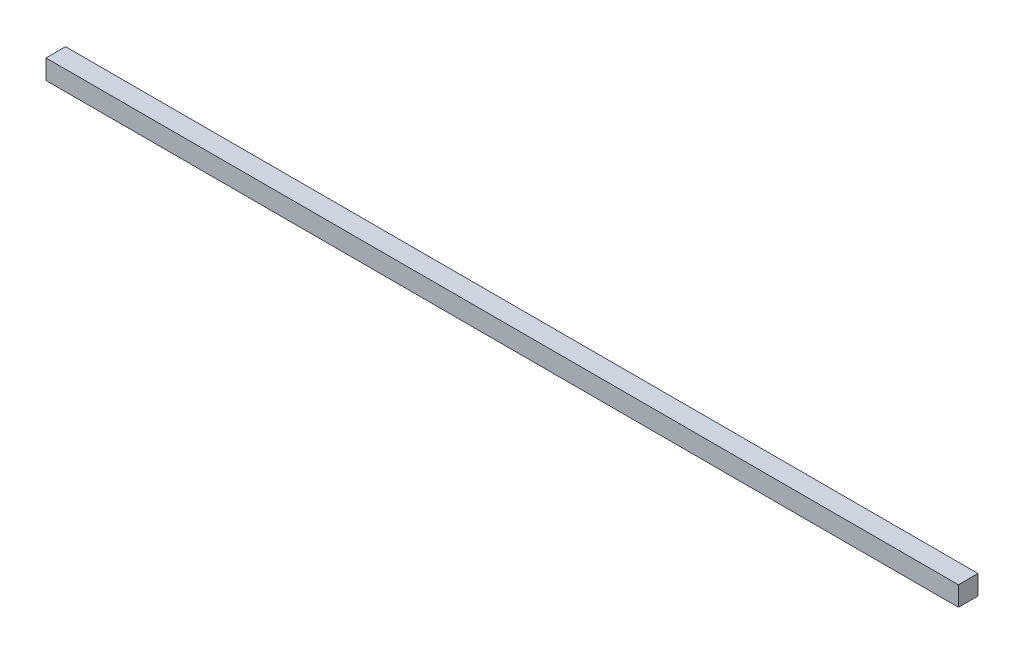
from build123d import *

# Parameters (mm, degrees)
SKETCH1_W           = 4150
SKETCH1_H           = 88.9
BOSS_EXTRUDE1_DEPTH = 88.9


with BuildPart() as part:
    # Sketch1 → Boss-Extrude1 (new body)
    with BuildSketch(Plane.XY):
        with Locations((2075, 44.45)):
            Rectangle(SKETCH1_W, SKETCH1_H)
    extrude(amount=BOSS_EXTRUDE1_DEPTH)


solid = part.part
